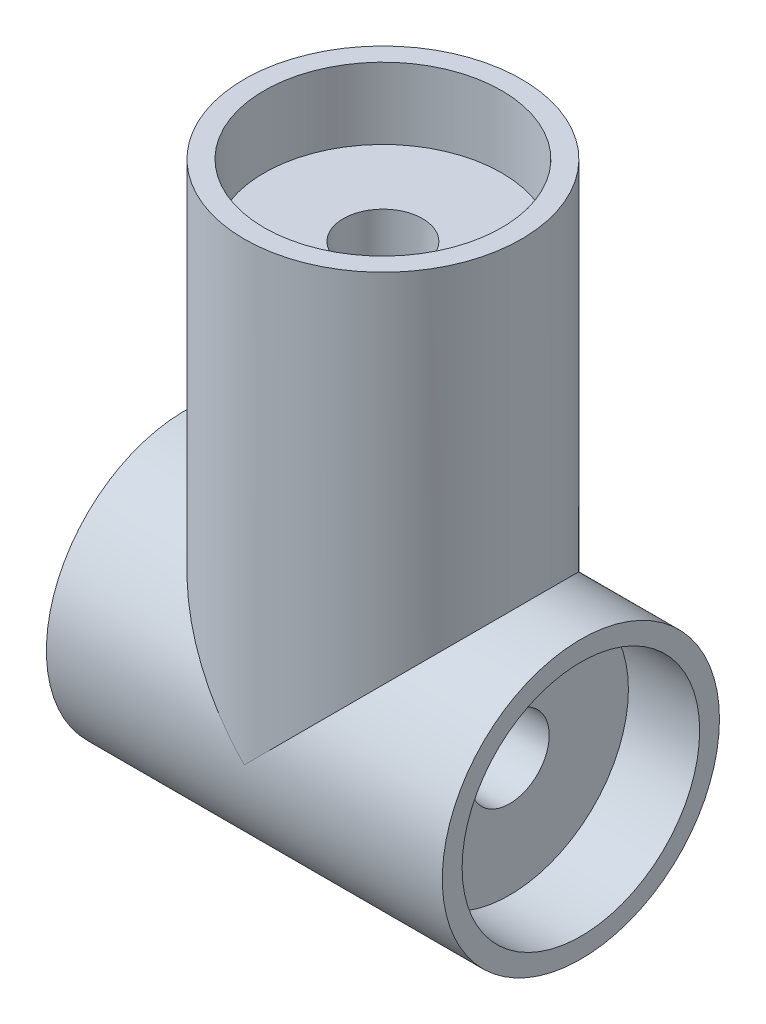
from build123d import *

# Parameters (mm, degrees)
SKETCH2_R                = 17.5
SKETCH2_R_2              = 5
BOSS_EXTRUDE1_DEPTH      = 25
CUT_EXTRUDE1_START       = -9
SKETCH3_R                = 15
SKETCH3_R_2              = 5
CUT_EXTRUDE1_DEPTH       = 9
BOSS_EXTRUDE2_REACH      = 82.971
BOSS_EXTRUDE2_END_RADIUS = 17.5
SKETCH5_R                = 17.5
SKETCH5_R_2              = 5
SKETCH6_R                = 15
SKETCH6_R_2              = 5
CUT_EXTRUDE2_DEPTH       = 9


with BuildPart() as part:
    # Sketch2 → Boss-Extrude1 (new, symmetric)
    with BuildSketch(Plane(origin=(0, 0, 0), x_dir=(0, 0, -1), z_dir=(1, 0, 0))):
        Circle(SKETCH2_R)
        Circle(SKETCH2_R_2, mode=Mode.SUBTRACT)
    extrude(amount=BOSS_EXTRUDE1_DEPTH, both=True)

    # Sketch3 → Cut-Extrude1 (cut)
    with BuildSketch(Plane(origin=(25, 0, 0), x_dir=(0, 0, -1), z_dir=(1, 0, 0)).offset(CUT_EXTRUDE1_START)):
        Circle(SKETCH3_R)
        Circle(SKETCH3_R_2, mode=Mode.SUBTRACT)
    cut_extrude1 = extrude(amount=CUT_EXTRUDE1_DEPTH, mode=Mode.SUBTRACT)

    # Mirror1: Cut-Extrude1 across plane
    add(cut_extrude1.mirror(Plane(origin=(0, 0, 0), x_dir=(0, 0, 1), z_dir=(1, 0, 0))), mode=Mode.SUBTRACT)

    # Boss-Extrude2: up to this cylinder (the profile starts outside it)
    boss_extrude2_end = Plane(origin=(0, 0, 0), z_dir=(-1, 0, 0)) * Cylinder(BOSS_EXTRUDE2_END_RADIUS, 201.942, mode=Mode.PRIVATE)
    # Sketch5 → Boss-Extrude2 (add, up to the surface)
    with BuildSketch(Plane(origin=(0, 57.5, 0), x_dir=(1, 0, 0), z_dir=(0, 1, 0)), mode=Mode.PRIVATE) as boss_extrude2_sk1:
        with Locations(Location((0, 0, 0), (0, 0, 270))):
            Circle(SKETCH5_R)
        with Locations(Location((0, 0, 0), (0, 0, 270))):
            Circle(SKETCH5_R_2, mode=Mode.SUBTRACT)
    boss_extrude2_tool1 = extrude(boss_extrude2_sk1.sketch, amount=-BOSS_EXTRUDE2_REACH, mode=Mode.PRIVATE) - boss_extrude2_end
    add(boss_extrude2_tool1.solids().sort_by_distance((0, 57.5, -17.005025))[0])

    # Sketch6 → Cut-Extrude2 (cut)
    with BuildSketch(Plane(origin=(0, 57.5, 0), x_dir=(1, 0, 0), z_dir=(0, 1, 0))):
        with Locations(Location((0, 0, 0), (0, 0, 270))):
            Circle(SKETCH6_R)
        with Locations(Location((0, 0, 0), (0, 0, 270))):
            Circle(SKETCH6_R_2, mode=Mode.SUBTRACT)
    extrude(amount=-CUT_EXTRUDE2_DEPTH, mode=Mode.SUBTRACT)


solid = part.part
